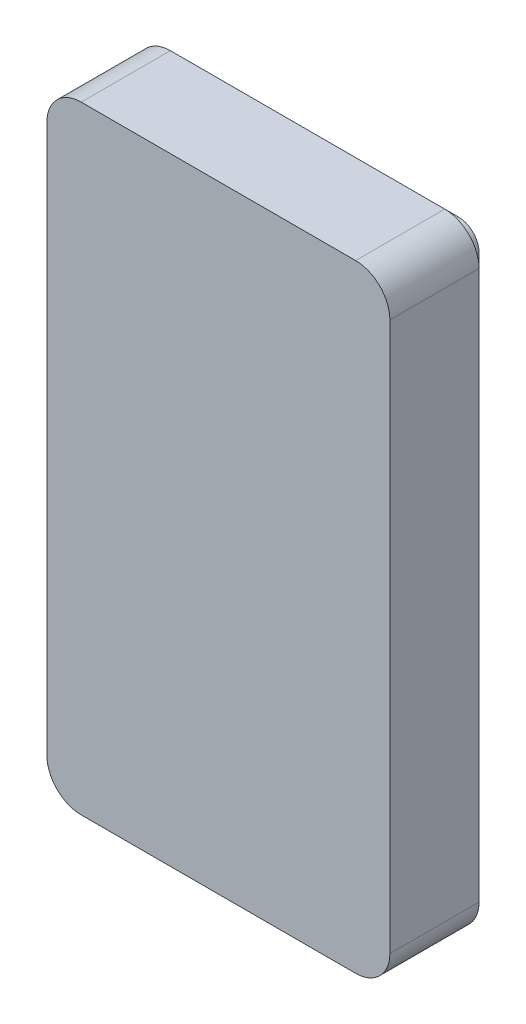
from build123d import *

# Parameters (mm, degrees)
SKETCH1_W           = 63.5
SKETCH1_H           = 114.3
SKETCH1_W_2         = 38.1
SKETCH1_H_2         = 69.85
SKETCH1_W_3         = 50.8
SKETCH1_H_3         = 27.94
BOSS_EXTRUDE1_DEPTH = 19.05
SKETCH1_4_W         = 50.8
SKETCH1_4_H         = 27.94
CUT_EXTRUDE1_DEPTH  = 17.78
SKETCH3_W           = 8.203339587
SKETCH3_H           = 4.126489459
CUT_EXTRUDE2_DEPTH  = 17.78
SKETCH1_6_W         = 38.1
SKETCH1_6_H         = 69.85
CUT_EXTRUDE4_DEPTH  = 17.78
SKETCH7_W           = 5.588
SKETCH7_H           = 4.749156964
SKETCH7_W_2         = 6.35
SKETCH7_H_2         = 6.35
BOSS_EXTRUDE2_DEPTH = 11.43
CUT_EXTRUDE5_START  = 11.43
SKETCH6_R           = 1.598803
CUT_EXTRUDE5_DEPTH  = 7.62
FILLET2_R           = 6.35
CUT_EXTRUDE6_START  = -2.54
CUT_EXTRUDE6_DEPTH  = 2.54


with BuildPart() as part:
    # Sketch1 → Boss-Extrude1 (new body)
    # profile 1 of 3: a face of its own
    with BuildSketch(Plane.XY):
        with Locations((31.75, -57.15)):
            Rectangle(SKETCH1_W, SKETCH1_H)
        with Locations((31.75, -39.50921232)):
            Rectangle(SKETCH1_W_2, SKETCH1_H_2, mode=Mode.SUBTRACT)
        with Locations((31.75, -92.530701779)):
            Rectangle(SKETCH1_W_3, SKETCH1_H_3, mode=Mode.SUBTRACT)
    # profile 2 of 3: a face of its own
    with BuildSketch(Plane.XY):
        with Locations((31.75, -39.50921232)):
            Rectangle(SKETCH1_W_2, SKETCH1_H_2)
    # profile 3 of 3: a face of its own
    with BuildSketch(Plane.XY):
        with Locations((31.75, -92.530701779)):
            Rectangle(SKETCH1_W_3, SKETCH1_H_3)
    extrude(amount=BOSS_EXTRUDE1_DEPTH)

    # Sketch1<4> → Cut-Extrude1 (cut)
    with BuildSketch(Plane.XY):
        with Locations((31.75, -92.530701779)):
            Rectangle(SKETCH1_4_W, SKETCH1_4_H)
    extrude(amount=CUT_EXTRUDE1_DEPTH, mode=Mode.SUBTRACT)

    # Sketch3 → Cut-Extrude2 (cut)
    with BuildSketch(Plane(origin=(0, 0, 0), x_dir=(-1, 0, 0), z_dir=(0, 0, -1))):
        with Locations((-46.698330207, -76.497457049)):
            Rectangle(SKETCH3_W, SKETCH3_H)
    extrude(amount=-CUT_EXTRUDE2_DEPTH, mode=Mode.SUBTRACT)

    # Sketch1<6> → Cut-Extrude4 (cut)
    with BuildSketch(Plane.XY):
        with Locations((31.75, -39.50921232)):
            Rectangle(SKETCH1_6_W, SKETCH1_6_H)
    extrude(amount=CUT_EXTRUDE4_DEPTH, mode=Mode.SUBTRACT)

    # Sketch7 → Boss-Extrude2 (add)
    with BuildSketch(Plane(origin=(0, 0, 17.78), x_dir=(-1, 0, 0), z_dir=(0, 0, -1))):
        with Locations((-48.006, -70.764233838)):
            Rectangle(SKETCH7_W, SKETCH7_H)
        with Locations((-15.875, -71.25921232)):
            Rectangle(SKETCH7_W_2, SKETCH7_H_2)
        with Locations((-15.875, -7.75921232)):
            Rectangle(SKETCH7_W_2, SKETCH7_H_2)
        with Locations((-47.625, -7.75921232)):
            Rectangle(SKETCH7_W_2, SKETCH7_H_2)
    extrude(amount=BOSS_EXTRUDE2_DEPTH)

    # Sketch6 → Cut-Extrude5 (cut)
    with BuildSketch(Plane(origin=(0, 0, 17.78), x_dir=(-1, 0, 0), z_dir=(0, 0, -1)).offset(CUT_EXTRUDE5_START)):
        with Locations((-47.879, -70.59881232)):
            Circle(SKETCH6_R)
        with Locations((-16.0782, -70.59881232)):
            Circle(SKETCH6_R)
        with Locations((-47.879, -8.39421232)):
            Circle(SKETCH6_R)
        with Locations((-16.0782, -8.39421232)):
            Circle(SKETCH6_R)
    extrude(amount=-CUT_EXTRUDE5_DEPTH, mode=Mode.SUBTRACT)

    # Fillet2
    fillet2_edges = [part.edges().sort_by_distance(p)[0] for p in [
        (63.5, -114.3, 9.525),
        (0, -114.3, 9.525),
        (0, 0, 9.525),
        (63.5, 0, 9.525),
    ]]
    fillet(fillet2_edges, radius=FILLET2_R)

    # Sketch9 → Cut-Extrude6 (cut)
    with BuildSketch(Plane(origin=(0, 0, 0), x_dir=(-1, 0, 0), z_dir=(0, 0, -1)).offset(CUT_EXTRUDE6_START)):
        with BuildLine():
            ThreePointArc((-6.35, -114.3), (-1.859871939, -112.440128061), (0, -107.95))
            Line((0, -107.95), (0, -6.35))
            ThreePointArc((0, -6.35), (-1.859871939, -1.859871939), (-6.35, 0))
            Line((-6.35, 0), (-57.15, 0))
            ThreePointArc((-57.15, 0), (-61.640128061, -1.859871939), (-63.5, -6.35))
            Line((-63.5, -6.35), (-63.5, -107.95))
            ThreePointArc((-63.5, -107.95), (-61.640128061, -112.440128061), (-57.15, -114.3))
            Line((-57.15, -114.3), (-6.35, -114.3))
        make_face()
        with BuildLine():
            ThreePointArc((-60.96, -107.95), (-59.844076836, -110.644076836), (-57.15, -111.76))
            Line((-57.15, -111.76), (-6.35, -111.76))
            ThreePointArc((-6.35, -111.76), (-3.655923164, -110.644076836), (-2.54, -107.95))
            Line((-2.54, -107.95), (-2.54, -6.35))
            ThreePointArc((-2.54, -6.35), (-3.655923164, -3.655923164), (-6.35, -2.54))
            Line((-6.35, -2.54), (-57.15, -2.54))
            ThreePointArc((-57.15, -2.54), (-59.844076836, -3.655923164), (-60.96, -6.35))
            Line((-60.96, -6.35), (-60.96, -107.95))
        make_face(mode=Mode.SUBTRACT)
    extrude(amount=CUT_EXTRUDE6_DEPTH, mode=Mode.SUBTRACT)


solid = part.part
